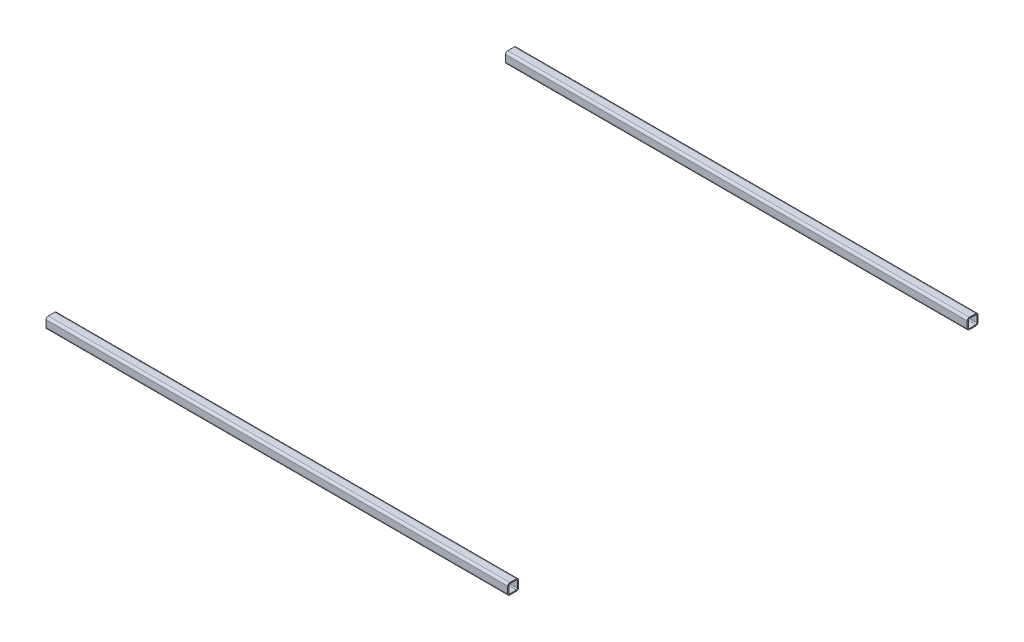
from build123d import *

# Parameters (mm, degrees)
SQUARE_TUBE_40_X_40_X_4_1_DEPTH   = 1708.15
SQUARE_TUBE_40_X_40_X_4_1_2_DEPTH = 1708.15


with BuildPart() as part:
    # Sketch12 → Square tube 40 X 40 X 4(1) (new body)
    with BuildSketch(Plane(origin=(854.075, 0, -850.011), x_dir=(0, 0, 1), z_dir=(-1, 0, 0))):
        with BuildLine():
            Line((-12, -20), (12, -20))
            ThreePointArc((12, -20), (17.656854249, -17.656854249), (20, -12))
            Line((20, -12), (20, 12))
            ThreePointArc((20, 12), (17.656854249, 17.656854249), (12, 20))
            Line((12, 20), (-12, 20))
            ThreePointArc((-12, 20), (-17.656854249, 17.656854249), (-20, 12))
            Line((-20, 12), (-20, -12))
            ThreePointArc((-20, -12), (-17.656854249, -17.656854249), (-12, -20))
        make_face()
        with BuildLine():
            Line((-12, -16), (12, -16))
            ThreePointArc((12, -16), (14.828427125, -14.828427125), (16, -12))
            Line((16, -12), (16, 12))
            ThreePointArc((16, 12), (14.828427125, 14.828427125), (12, 16))
            Line((12, 16), (-12, 16))
            ThreePointArc((-12, 16), (-14.828427125, 14.828427125), (-16, 12))
            Line((-16, 12), (-16, -12))
            ThreePointArc((-16, -12), (-14.828427125, -14.828427125), (-12, -16))
        make_face(mode=Mode.SUBTRACT)
    extrude(amount=SQUARE_TUBE_40_X_40_X_4_1_DEPTH)


with BuildPart() as body_2:
    # Sketch12 on segment 2 (carried to segment 2) → Square tube 40 X 40 X 4_1 2 (new body)
    with BuildSketch(Plane(origin=(854.075, 0, 850.011), x_dir=(0, 0, 1), z_dir=(-1, 0, 0))):
        with BuildLine():
            Line((-12, -20), (12, -20))
            ThreePointArc((12, -20), (17.656854249, -17.656854249), (20, -12))
            Line((20, -12), (20, 12))
            ThreePointArc((20, 12), (17.656854249, 17.656854249), (12, 20))
            Line((12, 20), (-12, 20))
            ThreePointArc((-12, 20), (-17.656854249, 17.656854249), (-20, 12))
            Line((-20, 12), (-20, -12))
            ThreePointArc((-20, -12), (-17.656854249, -17.656854249), (-12, -20))
        make_face()
        with BuildLine():
            Line((-12, -16), (12, -16))
            ThreePointArc((12, -16), (14.828427125, -14.828427125), (16, -12))
            Line((16, -12), (16, 12))
            ThreePointArc((16, 12), (14.828427125, 14.828427125), (12, 16))
            Line((12, 16), (-12, 16))
            ThreePointArc((-12, 16), (-14.828427125, 14.828427125), (-16, 12))
            Line((-16, 12), (-16, -12))
            ThreePointArc((-16, -12), (-14.828427125, -14.828427125), (-12, -16))
        make_face(mode=Mode.SUBTRACT)
    extrude(amount=SQUARE_TUBE_40_X_40_X_4_1_2_DEPTH)


solid = Compound([part.part, body_2.part])
